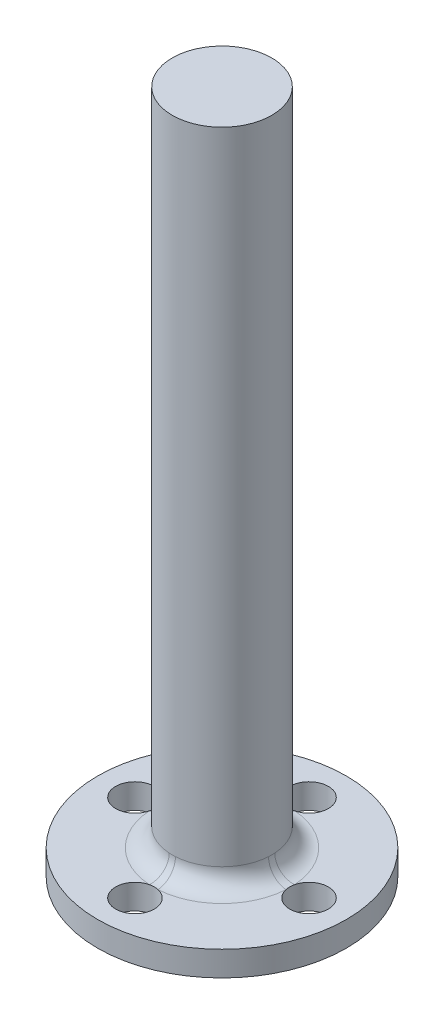
from build123d import *

# Parameters (mm, degrees)
SKETCH_1_R          = 10
EXTRUDE_1_DEPTH     = 2
SKETCH_2_R          = 1.55
CUT_EXTRUDE_1_DEPTH = 2
SKETCH_3_R          = 4
EXTRUDE_2_DEPTH     = 53
FILLET_1_R          = 1.5


with BuildPart() as part:
    # 草图1 → 凸台-拉伸1 (new body)
    with BuildSketch(Plane(origin=(0, 0, 0), x_dir=(1, 0, 0), z_dir=(0, 1, 0))):
        with Locations(Location((0, 0, 0), (0, 0, 270))):
            Circle(SKETCH_1_R)
    extrude(amount=EXTRUDE_1_DEPTH)

    # 草图2 → 切除-拉伸1 (cut)
    with BuildSketch(Plane(origin=(0, 2, 0), x_dir=(1, 0, 0), z_dir=(0, 1, 0))):
        with Locations(Location((0, 7, 0), (0, 0, 270))):
            Circle(SKETCH_2_R)
        with Locations(Location((7, 0, 0), (0, 0, 270))):
            Circle(SKETCH_2_R)
        with Locations(Location((-7, 0, 0), (0, 0, 270))):
            Circle(SKETCH_2_R)
        with Locations(Location((0, -7, 0), (0, 0, 270))):
            Circle(SKETCH_2_R)
    extrude(amount=-CUT_EXTRUDE_1_DEPTH, mode=Mode.SUBTRACT)

    # 草图3 → 凸台-拉伸2 (add)
    with BuildSketch(Plane(origin=(0, 2, 0), x_dir=(1, 0, 0), z_dir=(0, 1, 0))):
        with Locations(Location((0, 0, 0), (0, 0, 270))):
            Circle(SKETCH_3_R)
    extrude(amount=EXTRUDE_2_DEPTH)

    # 圆角1
    fillet_1_edges = [part.edges().sort_by_distance(p)[0] for p in [
        (0, 2, -4),
    ]]
    fillet(fillet_1_edges, radius=FILLET_1_R)


solid = part.part
